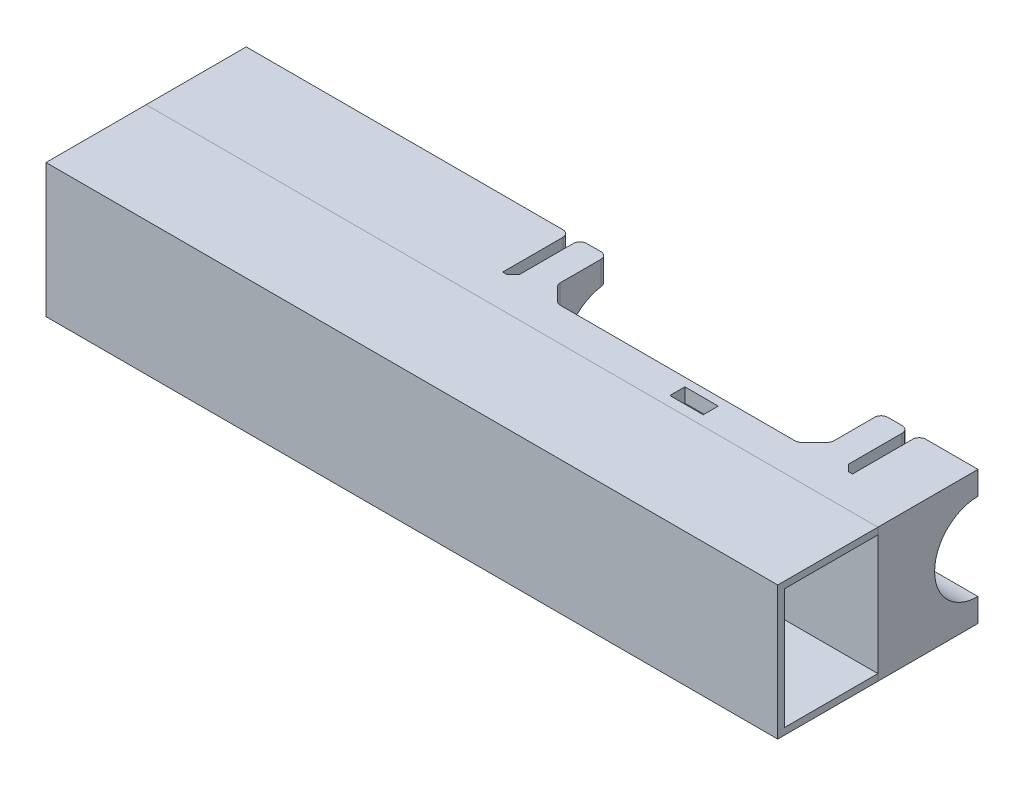
from build123d import *

# Parameters (mm, degrees)
BOSS_EXTRUDE1_DEPTH     = 40
SKETCH2_R               = 13
CUT_EXTRUDE1_DEPTH      = 210.771304043
CHAMFER1_SIZE           = 5
FILLET3_R               = 2
CHAMFER2_SIZE           = 2
CUT_EXTRUDE2_REACH      = 126.101
CUT_EXTRUDE2_END_RADIUS = 13.5
SKETCH3_W               = 45
SKETCH3_H               = 7.5
SKETCH4_W               = 68.34314575
SKETCH4_H               = 31.5
CUT_EXTRUDE3_DEPTH      = 8
BOSS_EXTRUDE2_START     = 48.25
BOSS_EXTRUDE2_DEPTH     = 48.25
SKETCH6_W               = 28
SKETCH6_H               = 36
CUT_EXTRUDE4_DEPTH      = 257.563954128
CUT_EXTRUDE5_REACH      = 161.611
SKETCH7_W               = 10
SKETCH7_H               = 4.5
SKETCH9_R               = 1.325
CUT_EXTRUDE6_DEPTH      = 158.402549261
SKETCH10_W              = 31
SKETCH10_H              = 40
CUT_EXTRUDE7_DEPTH      = 166.757541331


with BuildPart() as part:
    # Sketch1 → Boss-Extrude1 (new body)
    with BuildSketch(Plane(origin=(0, 0, 0), x_dir=(1, 0, 0), z_dir=(0, 1, 0))):
        Polygon((41, 0), (-41, 0), (-41, 20), (-49.25, 20), (-49.25, 0), (-52.4, 0), (-52.4, 20), (-101, 20), (-101, -40), (101, -40), (101, 20), (52.4, 20), (52.4, 0), (49.25, 0), (49.25, 20), (41, 20), align=None)
    extrude(amount=BOSS_EXTRUDE1_DEPTH)

    # Sketch2 → Cut-Extrude1 (cut, through all)
    with BuildSketch(Plane.ZY.offset(101)):
        with Locations((-20, 20)):
            Circle(SKETCH2_R)
    extrude(amount=-CUT_EXTRUDE1_DEPTH, mode=Mode.SUBTRACT)

    # Chamfer1
    chamfer1_edges = [part.edges().sort_by_distance(p)[0] for p in [
        (-41, 20, 0),
        (41, 20, 0),
    ]]
    chamfer(chamfer1_edges, length=CHAMFER1_SIZE)

    # Fillet3
    fillet3_edges = [part.edges().sort_by_distance(p)[0] for p in [
        (41, 36.5, -20),
        (49.25, 36.5, -20),
        (52.4, 36.5, -20),
        (-52.4, 36.5, -20),
        (-49.25, 36.5, -20),
        (-41, 36.5, -20),
        (41, 3.5, -20),
        (49.25, 3.5, -20),
        (52.4, 3.5, -20),
        (-52.4, 3.5, -20),
        (-49.25, 3.5, -20),
        (-41, 3.5, -20),
        (-36, 20, 0),
        (36, 20, 0),
        (41, 20, -5),
        (-41, 20, -5),
    ]]
    fillet(fillet3_edges, radius=FILLET3_R)

    # Chamfer2
    chamfer2_edges = [part.edges().sort_by_distance(p)[0] for p in [
        (49.25, 20, 0),
        (-49.25, 20, 0),
    ]]
    chamfer(chamfer2_edges, length=CHAMFER2_SIZE)

    # Cut-Extrude2: up to this cylinder (the profile starts inside it)
    cut_extrude2_end = Plane(origin=(-78.5, 20, -20), z_dir=(-1, 0, 0)) * Cylinder(CUT_EXTRUDE2_END_RADIUS, 280.202, mode=Mode.PRIVATE)
    # Sketch3 → Cut-Extrude2 (cut, up to the surface)
    with BuildSketch(Plane(origin=(0, 0, -20), x_dir=(-1, 0, 0), z_dir=(0, 0, -1)), mode=Mode.PRIVATE) as cut_extrude2_sk1:
        with Locations((78.5, 13.25)):
            Rectangle(SKETCH3_W, SKETCH3_H)
    cut_extrude2_tool1 = extrude(cut_extrude2_sk1.sketch, amount=-CUT_EXTRUDE2_REACH, mode=Mode.PRIVATE) & cut_extrude2_end
    add(cut_extrude2_tool1.solids().sort_by_distance((-78.5, 13.25, -20))[0], mode=Mode.SUBTRACT)
    # Sketch3 → Cut-Extrude2 (cut, up to the surface)
    with BuildSketch(Plane(origin=(0, 0, -20), x_dir=(-1, 0, 0), z_dir=(0, 0, -1)), mode=Mode.PRIVATE) as cut_extrude2_sk2:
        with Locations((78.5, 26.75)):
            Rectangle(SKETCH3_W, SKETCH3_H)
    cut_extrude2_tool2 = extrude(cut_extrude2_sk2.sketch, amount=-CUT_EXTRUDE2_REACH, mode=Mode.PRIVATE) & cut_extrude2_end
    add(cut_extrude2_tool2.solids().sort_by_distance((-78.5, 26.75, -20))[0], mode=Mode.SUBTRACT)

    # Sketch4 → Cut-Extrude3 (cut)
    with BuildSketch(Plane(origin=(0, 0, 0), x_dir=(-1, 0, 0), z_dir=(0, 0, -1))):
        with Locations((0, 20)):
            Rectangle(SKETCH4_W, SKETCH4_H)
    extrude(amount=-CUT_EXTRUDE3_DEPTH, mode=Mode.SUBTRACT)

    # Sketch5 → Boss-Extrude2 (add)
    with BuildSketch(Plane.ZY.offset(101).offset(BOSS_EXTRUDE2_START)):
        with BuildLine():
            Line((-20, 7), (-20, 0))
            Line((-20, 0), (40, 0))
            Line((40, 0), (40, 40))
            Line((40, 40), (-20, 40))
            Line((-20, 40), (-20, 33))
            ThreePointArc((-20, 33), (-15.968871126, 32.359207094), (-12.335145142, 30.5))
            Line((-12.335145142, 30.5), (-11.514718626, 30.5))
            ThreePointArc((-11.514718626, 30.5), (-8.544934247, 27.143631331), (-6.837553419, 23))
            Line((-6.837553419, 23), (-7.350889359, 23))
            ThreePointArc((-7.350889359, 23), (-7, 20), (-7.350889359, 17))
            Line((-7.350889359, 17), (-6.837553419, 17))
            ThreePointArc((-6.837553419, 17), (-8.544934247, 12.856368669), (-11.514718626, 9.5))
            Line((-11.514718626, 9.5), (-12.335145142, 9.5))
            ThreePointArc((-12.335145142, 9.5), (-15.968871126, 7.640792906), (-20, 7))
        make_face()
    extrude(amount=-BOSS_EXTRUDE2_DEPTH)

    # Sketch6 → Cut-Extrude4 (cut, through all)
    with BuildSketch(Plane.ZY.offset(149.25)):
        with Locations((24, 20)):
            Rectangle(SKETCH6_W, SKETCH6_H)
    extrude(amount=-CUT_EXTRUDE4_DEPTH, mode=Mode.SUBTRACT)

    # Sketch7 → Cut-Extrude5 (cut, up to next)
    with BuildSketch(Plane(origin=(0, 40, 0), x_dir=(1, 0, 0), z_dir=(0, 1, 0)), mode=Mode.PRIVATE) as cut_extrude5_sk1:
        with Locations((9.671572875, -4.75)):
            Rectangle(SKETCH7_W, SKETCH7_H)
    cut_extrude5_tool1 = extrude(cut_extrude5_sk1.sketch, amount=-CUT_EXTRUDE5_REACH, mode=Mode.PRIVATE) & part.part
    add(cut_extrude5_tool1.solids().sort_by_distance((9.671573, 40, 4.75))[0], mode=Mode.SUBTRACT)

    # Sketch9 → Cut-Extrude6 (cut, through all)
    with BuildSketch(Plane.XY.offset(10)):
        Polygon((20.171572875, 11.35), (-25.728427125, 11.35), (-25.728427125, 4.25), (27.271572875, 4.25), (27.271572875, 16.35), (20.171572875, 16.35), align=None)
        with Locations((29.796572875, 8.025)):
            Circle(SKETCH9_R)
        with Locations((29.796572875, 31.075)):
            Circle(SKETCH9_R)
        with Locations((-28.253427125, 8.025)):
            Circle(SKETCH9_R)
        with Locations((-28.253427125, 31.075)):
            Circle(SKETCH9_R)
    extrude(amount=-CUT_EXTRUDE6_DEPTH, mode=Mode.SUBTRACT)

    # Sketch10 → Cut-Extrude7 (cut, through all)
    with BuildSketch(Plane(origin=(0, 0, -20), x_dir=(-1, 0, 0), z_dir=(0, 0, -1))):
        with Locations((-85.5, 20)):
            Rectangle(SKETCH10_W, SKETCH10_H)
    extrude(amount=-CUT_EXTRUDE7_DEPTH, mode=Mode.SUBTRACT)


with BuildPart() as body_2:
    # Split1: the piece on the far side of the plane
    add(part.part)
    split(bisect_by=Plane.XY.offset(10), keep=Keep.BOTTOM)


with BuildPart() as part_1:
    add(part.part)

    # Split1
    split(bisect_by=Plane.XY.offset(10), keep=Keep.TOP)


solid = Compound([body_2.part, part_1.part])
